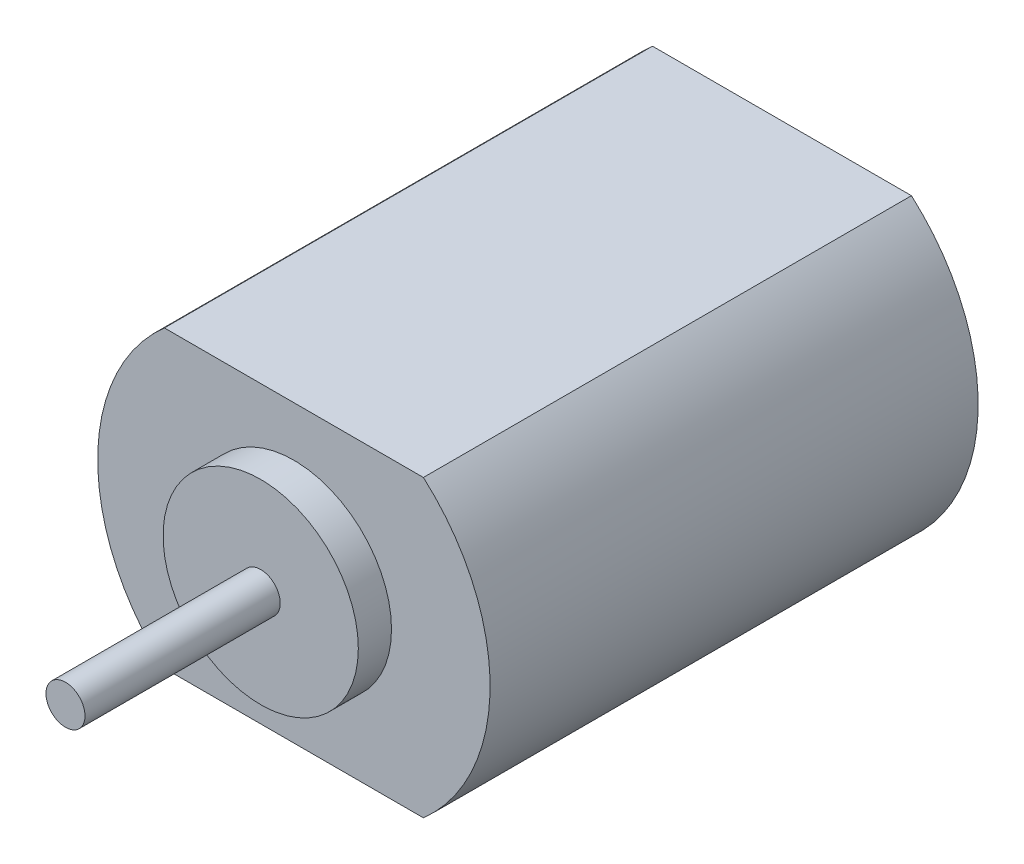
from build123d import *

# Parameters (mm, degrees)
BOSS_EXTRUDE1_DEPTH = 25
SKETCH2_R           = 5
BOSS_EXTRUDE2_DEPTH = 1.7
SKETCH3_R           = 1
BOSS_EXTRUDE3_DEPTH = 10


with BuildPart() as part:
    # Sketch1 → Boss-Extrude1 (new body)
    with BuildSketch(Plane.XY):
        with BuildLine():
            Line((-6.633249581, -7.55), (6.633249581, -7.55))
            ThreePointArc((6.633249581, -7.55), (10.05, 0), (6.633249581, 7.55))
            Line((6.633249581, 7.55), (-6.633249581, 7.55))
            ThreePointArc((-6.633249581, 7.55), (-10.05, 0), (-6.633249581, -7.55))
        make_face()
    extrude(amount=BOSS_EXTRUDE1_DEPTH)

    # Sketch2 → Boss-Extrude2 (add)
    with BuildSketch(Plane.XY.offset(25)):
        Circle(SKETCH2_R)
    extrude(amount=BOSS_EXTRUDE2_DEPTH)

    # Sketch3 → Boss-Extrude3 (add)
    with BuildSketch(Plane.XY.offset(26.7)):
        Circle(SKETCH3_R)
    extrude(amount=BOSS_EXTRUDE3_DEPTH)


solid = part.part
